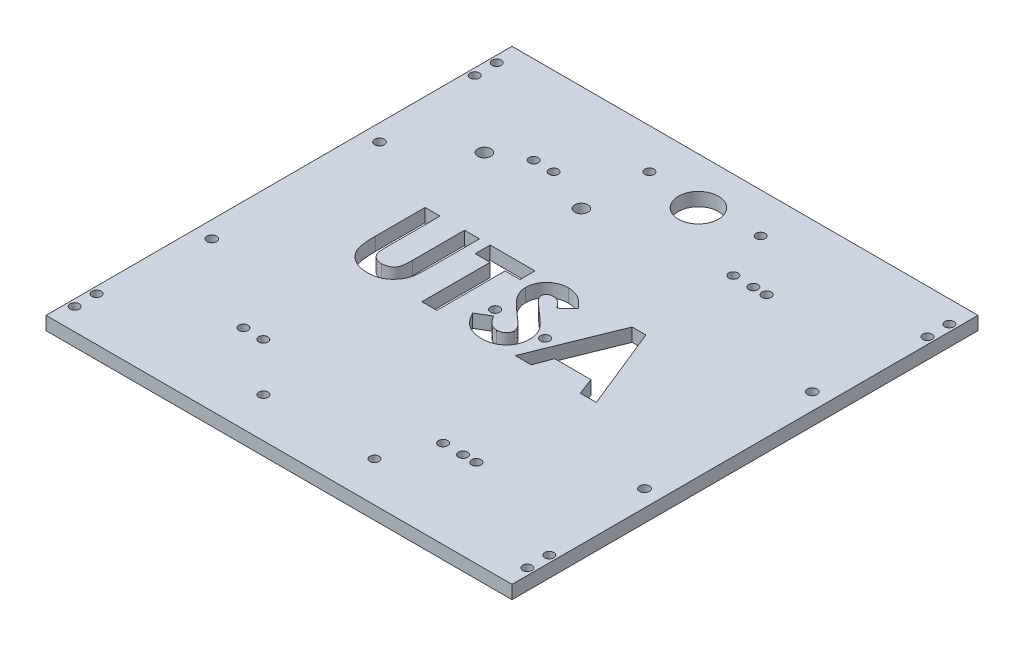
from build123d import *

# Parameters (mm, degrees)
SKETCH1_W               = 177.8
SKETCH1_H               = 177.8
BOSS_EXTRUDE2_DEPTH     = 5.08
CUT_EXTRUDE1_DEPTH      = 96.266
CUT_EXTRUDE1_DEPTH_BACK = 72.39
SKETCH5_R               = 1.7526
CUT_EXTRUDE2_DEPTH      = 37.084
SKETCH6_R               = 1.85
CUT_EXTRUDE3_DEPTH      = 14.478
SKETCH7_R               = 1.7526
CUT_EXTRUDE4_DEPTH      = 228.6
SKETCH8_R               = 7.62
CUT_EXTRUDE6_DEPTH      = 20.574
SKETCH9_R               = 1.7526
CUT_EXTRUDE7_DEPTH      = 15.748
SKETCH10_R              = 1.778
CUT_EXTRUDE8_DEPTH      = 46.482
SKETCH11_R              = 1.778
CUT_EXTRUDE9_DEPTH      = 29.21
SKETCH12_R              = 1.778
CUT_EXTRUDE11_DEPTH     = 19.05
SKETCH13_R              = 2.5
CUT_EXTRUDE12_DEPTH     = 15.494
SKETCH14_R              = 1.7526
SKETCH14_R_2            = 1.778
CUT_EXTRUDE13_DEPTH     = 19.304
CUT_EXTRUDE14_DEPTH     = 27.432


with BuildPart() as part:
    # Sketch1 → Boss-Extrude2 (new body)
    with BuildSketch(Plane(origin=(0, 0, 0), x_dir=(1, 0, 0), z_dir=(0, 1, 0))):
        with Locations((-12.211538462, -44.938461538)):
            Rectangle(SKETCH1_W, SKETCH1_H)
    extrude(amount=BOSS_EXTRUDE2_DEPTH)

    # Sketch4 → Cut-Extrude1 (cut, two sides: drawn at the far end of the back side and taken through both)
    # profile 1 of 4: a face of its own
    with BuildSketch(Plane(origin=(0, 0, 0), x_dir=(1, 0, 0), z_dir=(0, 1, 0)).offset(-CUT_EXTRUDE1_DEPTH_BACK)):
        with BuildLine():
            Line((-64.428076923, -25.888461538), (-58.729358974, -25.888461538))
            Line((-58.729358974, -25.888461538), (-58.729358974, -46.546314103))
            add(Edge.make_bspline(
                [(-58.729358974, -46.546314103), (-58.729049106, -46.760485758), (-58.728450599, -47.174156098), (-58.698489018, -47.767637598), (-58.671072105, -48.313171358), (-58.621604211, -48.810160136), (-58.548523178, -49.258816526), (-58.477756891, -49.662022536), (-58.381981719, -50.01255922), (-58.238046948, -50.411561738), (-58.016290716, -50.859862862), (-57.653953336, -51.327092577), (-57.235846997, -51.753507508), (-56.734722468, -52.10843914), (-56.171502815, -52.395546839), (-55.54928268, -52.60826187), (-54.868939172, -52.726503185), (-54.398518956, -52.744554887), (-54.156392228, -52.753846154)],
                knots=[0, 0, 0, 0, 1.155499968, 2.231836252, 3.205919964, 4.102923608, 4.924856345, 5.658536265, 6.31071849, 6.882491295, 7.94666036, 8.992281882, 10.060072772, 11.158554251, 12.289267114, 13.461410017, 14.693379945, 16, 16, 16, 16], degree=3))
            add(Edge.make_bspline(
                [(-54.156392228, -52.753846154), (-53.899162458, -52.746340003), (-53.397607958, -52.73170428), (-52.676201655, -52.588038814), (-52.007814624, -52.35927419), (-51.406598898, -52.032768771), (-50.873152783, -51.641394803), (-50.421601825, -51.195105836), (-50.065239468, -50.693011744), (-49.832975741, -50.22979171), (-49.702571097, -49.803438007), (-49.60482632, -49.422507152), (-49.533168585, -48.97304645), (-49.468158333, -48.462075198), (-49.42909218, -47.884300719), (-49.386731305, -47.244369551), (-49.371205651, -46.537903111), (-49.368559417, -46.04597727), (-49.367179487, -45.789453125)],
                knots=[0, 0, 0, 0, 1.261321664, 2.459363699, 3.594844139, 4.716940403, 5.803436589, 6.833651888, 7.818396249, 8.814403945, 9.360733334, 10.004355033, 10.743453831, 11.592799886, 12.532235708, 13.585170094, 14.740740724, 16, 16, 16, 16], degree=3))
            Line((-49.367179487, -45.789453125), (-49.367179487, -25.888461538))
            Line((-49.367179487, -25.888461538), (-43.668461538, -25.888461538))
            Line((-43.668461538, -25.888461538), (-43.668461538, -44.829066506))
            add(Edge.make_bspline(
                [(-43.668461538, -44.829066506), (-43.669252909, -45.212802258), (-43.670774637, -45.950688683), (-43.694143798, -47.011083404), (-43.743892515, -47.979583886), (-43.785675698, -48.856473123), (-43.866540466, -49.6405698), (-43.950782585, -50.335222235), (-44.058156413, -50.937968735), (-44.217922213, -51.624122377), (-44.493630686, -52.414203166), (-44.938108889, -53.323946945), (-45.5023452, -54.214641211), (-46.169244321, -55.076487712), (-46.922234433, -55.877115337), (-47.744620131, -56.57996276), (-48.623335752, -57.174495889), (-49.567563245, -57.646177673), (-50.576499023, -58.014053906), (-51.660125753, -58.261248205), (-52.817704487, -58.428255777), (-53.617265998, -58.444298909), (-54.029188702, -58.452564103)],
                knots=[0, 0, 0, 0, 1.170808336, 2.251350247, 3.235597562, 4.129743112, 4.929140599, 5.639994148, 6.264258765, 6.79612947, 7.788252245, 8.809469599, 9.879094798, 10.999557536, 12.129761673, 13.226370002, 14.293821979, 15.358369427, 16.438775801, 17.562147481, 18.744053101, 20, 20, 20, 20], degree=3))
            add(Edge.make_bspline(
                [(-54.029188702, -58.452564103), (-54.302878341, -58.447954162), (-54.842862384, -58.438858844), (-55.63700365, -58.358661897), (-56.404697182, -58.240481752), (-57.144500491, -58.068069091), (-57.858981296, -57.845344135), (-58.547949775, -57.571185225), (-59.208845555, -57.247121585), (-59.837970357, -56.876133899), (-60.434549989, -56.47497458), (-60.979792977, -56.030272589), (-61.492462413, -55.574915316), (-61.957747491, -55.089739395), (-62.379142916, -54.579838345), (-62.755780824, -54.044056564), (-63.087101656, -53.482441641), (-63.381439606, -52.884870501), (-63.633364163, -52.22097076), (-63.845746029, -51.467127231), (-64.031287825, -50.611524169), (-64.16917154, -49.652233946), (-64.294177726, -48.592418275), (-64.373299749, -47.429316176), (-64.414692041, -46.162894277), (-64.423502558, -45.284910229), (-64.428076923, -44.829066506)],
                knots=[0, 0, 0, 0, 1.001158378, 1.975264943, 2.917723546, 3.841610987, 4.75185031, 5.653588123, 6.552117133, 7.442167995, 8.324307438, 9.179605724, 10.014504199, 10.831958861, 11.636465792, 12.43274043, 13.225645099, 14.020104002, 14.867201867, 15.819789774, 16.883317127, 18.068162734, 19.364263498, 20.787406516, 22.332041935, 24, 24, 24, 24], degree=3))
            Line((-64.428076923, -44.829066506), (-64.428076923, -25.888461538))
        make_face()
    # profile 2 of 4: a face of its own
    with BuildSketch(Plane(origin=(0, 0, 0), x_dir=(1, 0, 0), z_dir=(0, 1, 0)).offset(-CUT_EXTRUDE1_DEPTH_BACK)):
        Polygon((-39.597948718, -25.888461538), (-22.501794872, -25.888461538), (-22.501794872, -31.587179487), (-28.200512821, -31.587179487), (-28.200512821, -57.638461538), (-33.899230769, -57.638461538), (-33.899230769, -31.587179487), (-39.597948718, -31.587179487), align=None)
    # profile 3 of 4: a face of its own
    with BuildSketch(Plane(origin=(0, 0, 0), x_dir=(1, 0, 0), z_dir=(0, 1, 0)).offset(-CUT_EXTRUDE1_DEPTH_BACK)):
        with BuildLine():
            Line((-1.742179487, -30.130699119), (-6.003497596, -34.029487179))
            add(Edge.make_bspline(
                [(-6.003497596, -34.029487179), (-6.186034192, -33.772000335), (-6.536479, -33.2776615), (-7.104513481, -32.615730149), (-7.669982996, -32.051053447), (-8.238126275, -31.585990351), (-8.813979124, -31.223366466), (-9.396541946, -30.96662475), (-9.982512031, -30.803411604), (-10.376193475, -30.783087641), (-10.570104167, -30.773076923)],
                knots=[0, 0, 0, 0, 1.299362458, 2.494594718, 3.587462134, 4.587049575, 5.512617175, 6.380583204, 7.202344345, 8, 8, 8, 8], degree=3))
            add(Edge.make_bspline(
                [(-10.570104167, -30.773076923), (-10.750978497, -30.779420173), (-11.100199308, -30.791667322), (-11.598039483, -30.913403072), (-12.040029079, -31.123501098), (-12.425736736, -31.398221942), (-12.731274107, -31.729196869), (-12.975222003, -32.076304466), (-13.112585168, -32.459432753), (-13.130664863, -32.722580716), (-13.139615385, -32.852854567)],
                knots=[0, 0, 0, 0, 1.185010067, 2.2879431, 3.333075148, 4.379039566, 5.372662701, 6.27520591, 7.14612461, 8, 8, 8, 8], degree=3))
            add(Edge.make_bspline(
                [(-13.139615385, -32.852854567), (-13.134006546, -32.985007026), (-13.122711126, -33.251143712), (-13.013612739, -33.64120017), (-12.849170318, -34.022330736), (-12.692038871, -34.254343047), (-12.611720753, -34.372936699)],
                knots=[0, 0, 0, 0, 0.967525499, 1.948461899, 2.951351359, 4, 4, 4, 4], degree=3))
            add(Edge.make_bspline(
                [(-12.611720753, -34.372936699), (-12.538702896, -34.465118303), (-12.370625432, -34.677308183), (-12.050136132, -35.013383875), (-11.647668879, -35.425106016), (-11.147735887, -35.898316687), (-10.571090748, -36.450034394), (-9.891005216, -37.058570905), (-9.127055118, -37.742771888), (-8.584057088, -38.219224676), (-8.299521234, -38.468890224)],
                knots=[0, 0, 0, 0, 0.473873513, 1.090794244, 1.870441696, 2.795289791, 3.865433203, 5.087734844, 6.473946851, 8, 8, 8, 8], degree=3))
            add(Edge.make_bspline(
                [(-8.299521234, -38.468890224), (-8.032443405, -38.700032614), (-7.525585172, -39.138692848), (-6.80442656, -39.761300619), (-6.170648248, -40.32144565), (-5.615017532, -40.810721361), (-5.145957231, -41.234261377), (-4.761495415, -41.594090211), (-4.456936535, -41.88320266), (-4.283812644, -42.057826756), (-4.209927885, -42.132351763)],
                knots=[0, 0, 0, 0, 1.543621617, 2.929473131, 4.163658386, 5.240097082, 6.164993805, 6.925417477, 7.541396219, 8, 8, 8, 8], degree=3))
            add(Edge.make_bspline(
                [(-4.209927885, -42.132351763), (-3.929624511, -42.435700045), (-3.390782989, -43.018841975), (-2.690478965, -43.922528571), (-2.1141061, -44.804710955), (-1.668213122, -45.681988818), (-1.331456811, -46.567019535), (-1.094039151, -47.481508435), (-0.951848135, -48.435011355), (-0.936061612, -49.085660697), (-0.928076923, -49.414753606)],
                knots=[0, 0, 0, 0, 1.206664779, 2.319633467, 3.337109185, 4.282041471, 5.190008762, 6.099243693, 7.03861361, 8, 8, 8, 8], degree=3))
            add(Edge.make_bspline(
                [(-0.928076923, -49.414753606), (-0.93376022, -49.735414286), (-0.944911061, -50.364562475), (-1.081487475, -51.285227134), (-1.276237425, -52.16634317), (-1.577355012, -52.998322795), (-1.944355345, -53.794822701), (-2.404443267, -54.543435952), (-2.944753444, -55.25173882), (-3.564031868, -55.907069525), (-4.24902734, -56.501736717), (-4.983750085, -57.031123498), (-5.775384592, -57.468199716), (-6.617167259, -57.828100806), (-7.5086475, -58.105301438), (-8.448763293, -58.310178539), (-9.43895261, -58.433142546), (-10.116058333, -58.445996974), (-10.46198117, -58.452564103)],
                knots=[0, 0, 0, 0, 1.043214005, 2.046824704, 3.02475056, 3.976699089, 4.921714032, 5.875962561, 6.831408892, 7.817874052, 8.806269674, 9.781291748, 10.760897367, 11.74438705, 12.757449933, 13.795994037, 14.874007457, 16, 16, 16, 16], degree=3))
            add(Edge.make_bspline(
                [(-10.46198117, -58.452564103), (-10.733527651, -58.447746687), (-11.271345416, -58.438205442), (-12.064007493, -58.360309114), (-12.829412333, -58.23459273), (-13.566697778, -58.054403597), (-14.279185427, -57.826079526), (-14.966904542, -57.54719042), (-15.625107569, -57.213413602), (-16.258774785, -56.831612851), (-16.864825784, -56.388291887), (-17.450923844, -55.892514262), (-18.011247282, -55.336654694), (-18.548487217, -54.72202777), (-19.059206239, -54.046893013), (-19.560122014, -53.320652925), (-20.028972339, -52.529829476), (-20.31860204, -51.975060429), (-20.466538462, -51.691696715)],
                knots=[0, 0, 0, 0, 1.016823716, 2.013894106, 2.979844003, 3.91962641, 4.853723003, 5.779685073, 6.695824784, 7.614987388, 8.547259901, 9.504950863, 10.487499108, 11.500346958, 12.559593716, 13.656357062, 14.802919212, 16, 16, 16, 16], degree=3))
            Line((-20.466538462, -51.691696715), (-15.454719551, -48.683333333))
            add(Edge.make_bspline(
                [(-15.454719551, -48.683333333), (-15.269673198, -49.004988173), (-14.914923523, -49.62162799), (-14.313767034, -50.450161739), (-13.697912901, -51.159663748), (-13.053123128, -51.737593523), (-12.387238118, -52.191678728), (-11.697041492, -52.516199517), (-10.982048329, -52.717077519), (-10.495027469, -52.741609362), (-10.252095353, -52.753846154)],
                knots=[0, 0, 0, 0, 1.283663364, 2.460892379, 3.537111102, 4.529833553, 5.449777664, 6.316464042, 7.160231139, 8, 8, 8, 8], degree=3))
            add(Edge.make_bspline(
                [(-10.252095353, -52.753846154), (-10.00499861, -52.743852926), (-9.525594943, -52.72446461), (-8.841307555, -52.545380575), (-8.213926968, -52.264205503), (-7.671623821, -51.863007448), (-7.212435709, -51.399963916), (-6.873528525, -50.884806813), (-6.660624746, -50.327419264), (-6.638115655, -49.940221208), (-6.626794872, -49.745482772)],
                knots=[0, 0, 0, 0, 1.13588714, 2.203786484, 3.234766741, 4.283437687, 5.291419208, 6.222934724, 7.106237994, 8, 8, 8, 8], degree=3))
            add(Edge.make_bspline(
                [(-6.626794872, -49.745482772), (-6.637249152, -49.564310348), (-6.65848602, -49.196275913), (-6.81491025, -48.649067888), (-7.059449032, -48.102108722), (-7.348755655, -47.653478016), (-7.643161371, -47.277851687), (-7.924679638, -46.952388465), (-8.267494417, -46.592808583), (-8.670736481, -46.198659716), (-9.129077949, -45.766472073), (-9.642904916, -45.296287975), (-10.218101243, -44.792249181), (-10.624651142, -44.448902934), (-10.837231571, -44.269370994)],
                knots=[0, 0, 0, 0, 0.916159276, 1.861089862, 2.860218735, 3.940849679, 4.552606315, 5.27541173, 6.11797699, 7.06649574, 8.129236253, 9.306560635, 10.591630461, 12, 12, 12, 12], degree=3))
            add(Edge.make_bspline(
                [(-10.837231571, -44.269370994), (-11.241355426, -43.92744346), (-12.016991423, -43.271181029), (-13.113063494, -42.301902077), (-14.10072257, -41.396022083), (-14.971438168, -40.542342388), (-15.736304552, -39.75662848), (-16.390141713, -39.032498488), (-16.925766953, -38.364366741), (-17.489397023, -37.573009396), (-18.02495828, -36.608686097), (-18.487835185, -35.448493377), (-18.788130185, -34.288447869), (-18.821774063, -33.509657209), (-18.838333333, -33.126342147)],
                knots=[0, 0, 0, 0, 1.345494975, 2.582412109, 3.71882943, 4.751509156, 5.681369928, 6.505683931, 7.230279997, 7.856715994, 8.973648664, 10.023341002, 11.027102913, 12, 12, 12, 12], degree=3))
            add(Edge.make_bspline(
                [(-18.838333333, -33.126342147), (-18.831446355, -32.85451568), (-18.817878267, -32.31898834), (-18.696848834, -31.531573416), (-18.515965734, -30.771784174), (-18.253271544, -30.042392674), (-17.912326203, -29.344312507), (-17.498261331, -28.674126277), (-17.004647284, -28.038002226), (-16.448377577, -27.436362061), (-15.83551078, -26.886531416), (-15.180584724, -26.401250778), (-14.487306347, -25.991375696), (-13.759916776, -25.651354552), (-12.99390868, -25.391089967), (-12.194925206, -25.206601456), (-11.361820358, -25.096873574), (-10.795160423, -25.081957341), (-10.506502404, -25.074358974)],
                knots=[0, 0, 0, 0, 1.010766082, 1.991317756, 2.957454644, 3.913069143, 4.869106762, 5.843196583, 6.838735724, 7.860187025, 8.887984031, 9.89767229, 10.887916223, 11.879572884, 12.879850636, 13.892031539, 14.926195476, 16, 16, 16, 16], degree=3))
            add(Edge.make_bspline(
                [(-10.506502404, -25.074358974), (-10.132415897, -25.088043856), (-9.387195792, -25.115305595), (-8.285366373, -25.328483487), (-7.209145463, -25.663728177), (-6.341906485, -26.068164012), (-5.651860618, -26.459941197), (-5.12300492, -26.820640278), (-4.58486578, -27.233840462), (-4.033103442, -27.700843851), (-3.477970502, -28.230449402), (-2.903681878, -28.810049439), (-2.318062953, -29.444653061), (-1.937503503, -29.898010946), (-1.742179487, -30.130699119)],
                knots=[0, 0, 0, 0, 1.282922637, 2.555718331, 3.837320111, 5.142675274, 5.830281639, 6.55870424, 7.337177975, 8.157850921, 9.037902056, 9.96903443, 10.957596896, 12, 12, 12, 12], degree=3))
        make_face()
    # profile 4 of 4: a face of its own
    with BuildSketch(Plane(origin=(0, 0, 0), x_dir=(1, 0, 0), z_dir=(0, 1, 0)).offset(-CUT_EXTRUDE1_DEPTH_BACK)):
        Polygon((14.546231971, -25.888461538), (19.831538462, -25.888461538), (32.653653846, -57.638461538), (26.566965144, -57.638461538), (24.099216747, -51.125641026), (10.265833333, -51.125641026), (7.798084936, -57.638461538), (1.71775641, -57.638461538), align=None)
        Polygon((17.185705128, -34.40473758), (12.428293269, -45.426923077), (21.943116987, -45.426923077), align=None, mode=Mode.SUBTRACT)
    extrude(amount=CUT_EXTRUDE1_DEPTH + CUT_EXTRUDE1_DEPTH_BACK, mode=Mode.SUBTRACT)


with BuildPart() as cut_extrude1_piece_1:
    # of the separate pieces the step leaves, piece 1, a body of its own (cut_extrude1_pieces)
    add(part.part.solids().sort_by_distance((76.688461538, 0, -43.961538462))[0])

    # Sketch5 → Cut-Extrude2 (cut)
    with BuildSketch(Plane(origin=(0, 0, 0), x_dir=(1, 0, 0), z_dir=(0, 1, 0))):
        with Locations(Location((-98.571538462, 35.579538462, 0), (0, 0, 270))):
            Circle(SKETCH5_R)
        with Locations(Location((-98.571538462, 27.197538462, 0), (0, 0, 270))):
            Circle(SKETCH5_R)
        with Locations(Location((74.148461538, 27.197538462, 0), (0, 0, 90))):
            Circle(SKETCH5_R)
        with Locations(Location((74.148461538, 35.579538462, 0), (0, 0, 90))):
            Circle(SKETCH5_R)
        with Locations(Location((-98.571538462, -125.456461538, 0), (0, 0, 90))):
            Circle(SKETCH5_R)
        with Locations(Location((-98.571538462, -117.074461538, 0), (0, 0, 90))):
            Circle(SKETCH5_R)
        with Locations(Location((74.148461538, -125.456461538, 0), (0, 0, 270))):
            Circle(SKETCH5_R)
        with Locations(Location((74.148461538, -117.074461538, 0), (0, 0, 270))):
            Circle(SKETCH5_R)
    extrude(amount=CUT_EXTRUDE2_DEPTH, mode=Mode.SUBTRACT)

    # Sketch6 → Cut-Extrude3 (cut)
    with BuildSketch(Plane(origin=(0, 0, 0), x_dir=(1, 0, 0), z_dir=(0, 1, 0))):
        with Locations(Location((70.338461538, -76.938461538, 0), (0, 0, 270))):
            Circle(SKETCH6_R)
        with Locations(Location((70.338461538, -12.938461538, 0), (0, 0, 270))):
            Circle(SKETCH6_R)
        with Locations(Location((-94.761538462, -12.938461538, 0), (0, 0, 90))):
            Circle(SKETCH6_R)
        with Locations(Location((-94.761538462, -76.938461538, 0), (0, 0, 90))):
            Circle(SKETCH6_R)
    extrude(amount=CUT_EXTRUDE3_DEPTH, mode=Mode.SUBTRACT)

    # Sketch7 → Cut-Extrude4 (cut)
    with BuildSketch(Plane(origin=(0, 0, 0), x_dir=(1, 0, 0), z_dir=(0, 1, 0))):
        with Locations(Location((-59.326650038, -100.323208392, 0), (0, 0, 270))):
            Circle(SKETCH7_R)
        with Locations(Location((-51.706650038, -100.323208392, 0), (0, 0, 270))):
            Circle(SKETCH7_R)
        with Locations(Location((16.873349962, -100.323208392, 0), (0, 0, 270))):
            Circle(SKETCH7_R)
        with Locations(Location((24.493349962, -100.323208392, 0), (0, 0, 270))):
            Circle(SKETCH7_R)
    extrude(amount=CUT_EXTRUDE4_DEPTH, mode=Mode.SUBTRACT)

    # Sketch8 → Cut-Extrude6 (cut)
    with BuildSketch(Plane(origin=(0, 0, 0), x_dir=(1, 0, 0), z_dir=(0, 1, 0))):
        with Locations(Location((-12.211538462, 26.181538462, 0), (0, 0, 270))):
            Circle(SKETCH8_R)
    extrude(amount=CUT_EXTRUDE6_DEPTH, mode=Mode.SUBTRACT)

    # Sketch9 → Cut-Extrude7 (cut)
    with BuildSketch(Plane(origin=(0, 0, 0), x_dir=(1, 0, 0), z_dir=(0, 1, 0))):
        with Locations(Location((-33.418738462, 28.721538462, 0), (0, 0, 270))):
            Circle(SKETCH9_R)
        with Locations(Location((8.995661538, 28.721538462, 0), (0, 0, 270))):
            Circle(SKETCH9_R)
        with Locations(Location((8.995661538, -118.598461538, 0), (0, 0, 90))):
            Circle(SKETCH9_R)
        with Locations(Location((-33.418738462, -118.598461538, 0), (0, 0, 90))):
            Circle(SKETCH9_R)
    extrude(amount=CUT_EXTRUDE7_DEPTH, mode=Mode.SUBTRACT)

    # Sketch10 → Cut-Extrude8 (cut)
    with BuildSketch(Plane(origin=(0, 0, 0), x_dir=(1, 0, 0), z_dir=(0, 1, 0))):
        with Locations(Location((-17.335988462, -46.240211538, 0), (0, 0, 270))):
            Circle(SKETCH10_R)
    extrude(amount=CUT_EXTRUDE8_DEPTH, mode=Mode.SUBTRACT)

    # Sketch11 → Cut-Extrude9 (cut)
    with BuildSketch(Plane(origin=(0, 0, 0), x_dir=(1, 0, 0), z_dir=(0, 1, 0))):
        with Locations(Location((1.714011538, -46.240211538, 0), (0, 0, 270))):
            Circle(SKETCH11_R)
    extrude(amount=CUT_EXTRUDE9_DEPTH, mode=Mode.SUBTRACT)

    # Sketch12 → Cut-Extrude11 (cut)
    with BuildSketch(Plane(origin=(0, 0, 0), x_dir=(1, 0, 0), z_dir=(0, 1, 0))):
        with Locations(Location((29.573349962, -100.323208392, 0), (0, 0, 90))):
            Circle(SKETCH12_R)
    extrude(amount=CUT_EXTRUDE11_DEPTH, mode=Mode.SUBTRACT)

    # Sketch13 → Cut-Extrude12 (cut)
    with BuildSketch(Plane(origin=(0, 0, 0), x_dir=(1, 0, 0), z_dir=(0, 1, 0))):
        with Locations(Location((-71.269172613, 3.586538462, 0), (0, 0, 270))):
            Circle(SKETCH13_R)
        with Locations(Location((-34.269172613, 3.586538462, 0), (0, 0, 270))):
            Circle(SKETCH13_R)
    extrude(amount=CUT_EXTRUDE12_DEPTH, mode=Mode.SUBTRACT)

    # Sketch14 → Cut-Extrude13 (cut)
    with BuildSketch(Plane(origin=(0, 0, 0), x_dir=(1, 0, 0), z_dir=(0, 1, 0))):
        with Locations(Location((-59.326650038, -100.323208392, 0), (0, 0, 270))):
            Circle(SKETCH14_R)
        with Locations(Location((-51.706650038, -100.323208392, 0), (0, 0, 270))):
            Circle(SKETCH14_R)
        with Locations(Location((16.873349962, -100.323208392, 0), (0, 0, 270))):
            Circle(SKETCH14_R)
        with Locations(Location((24.493349962, -100.323208392, 0), (0, 0, 270))):
            Circle(SKETCH14_R)
        with Locations(Location((24.493349962, 10.446285315, 0), (0, 0, 90))):
            Circle(SKETCH14_R)
        with Locations(Location((16.873349962, 10.446285315, 0), (0, 0, 90))):
            Circle(SKETCH14_R)
        with Locations(Location((-51.706650038, 10.446285315, 0), (0, 0, 90))):
            Circle(SKETCH14_R)
        with Locations(Location((-59.326650038, 10.446285315, 0), (0, 0, 90))):
            Circle(SKETCH14_R)
        with Locations(Location((29.573349962, -100.323208392, 0), (0, 0, 90))):
            Circle(SKETCH14_R_2)
        with Locations(Location((29.573349962, 10.446285315, 0), (0, 0, 90))):
            Circle(SKETCH14_R_2)
    extrude(amount=CUT_EXTRUDE13_DEPTH, mode=Mode.SUBTRACT)


with BuildPart() as cut_extrude1_piece_2:
    # of the separate pieces the step leaves, piece 2, a body of its own (cut_extrude1_pieces)
    add(part.part.solids().sort_by_distance((21.943116987, 0, 45.426923077))[0])

    # Sketch15 → Cut-Extrude14 (cut)
    with BuildSketch(Plane(origin=(0, 0, 0), x_dir=(1, 0, 0), z_dir=(0, 1, 0))):
        Polygon((14.771517975, -31.506577073), (8.88145614, -48.054846038), (26.130922942, -48.054846038), (19.399423702, -31.506577073), align=None)
    extrude(amount=CUT_EXTRUDE14_DEPTH, mode=Mode.SUBTRACT)


solid = cut_extrude1_piece_1.part
